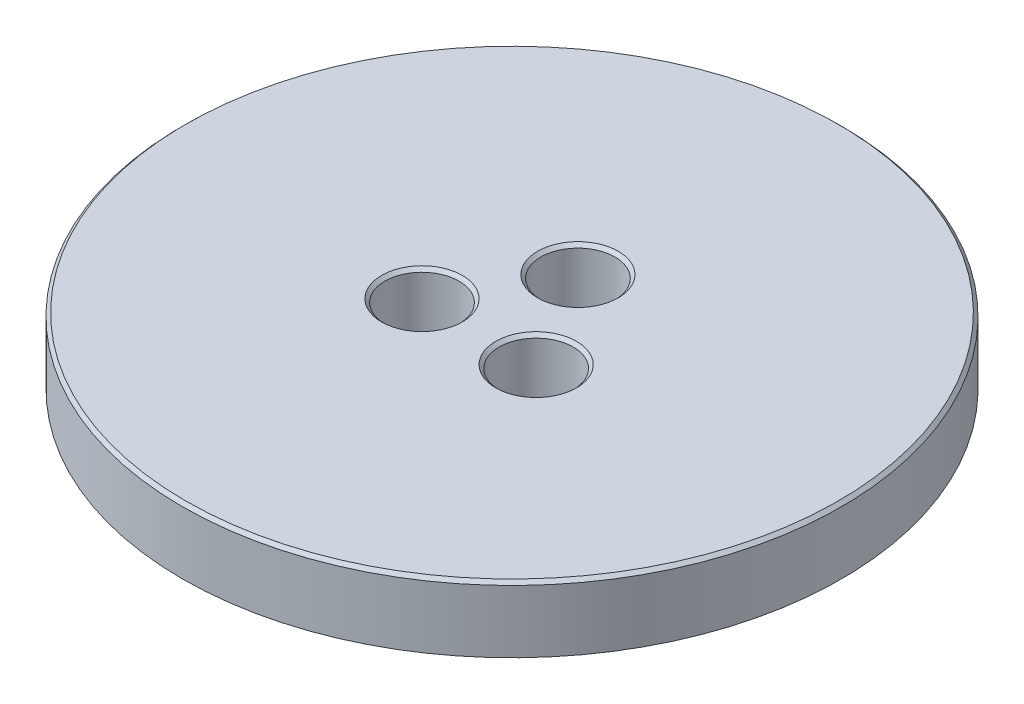
from build123d import *

# Parameters (mm, degrees)
SKETCH1_W          = 10
SKETCH1_H          = 2
SKETCH2_R          = 1.125
CUT_EXTRUDE1_DEPTH = 15.282856857
CHAMFER2_SIZE      = 0.1


with BuildPart() as part:
    # Sketch1 → Revolve1 (revolve)
    with BuildSketch(Plane.XY, mode=Mode.PRIVATE) as revolve1_sk:
        with Locations((5, 1)):
            Rectangle(SKETCH1_W, SKETCH1_H)
    revolve(revolve1_sk.sketch.rotate(Axis((0, 0, 0), (0, 1, 0)), 90), axis=Axis((0, 0, 0), (0, 1, 0)))

    # Sketch2 → Cut-Extrude1 (cut, through all)
    with BuildSketch(Plane(origin=(0, 0, 0), x_dir=(1, 0, 0), z_dir=(0, 1, 0))):
        with Locations(Location((-1.732050808, -1, 0), (0, 0, 270))):
            Circle(SKETCH2_R)
        with Locations(Location((1.732050808, -1, 0), (0, 0, 270))):
            Circle(SKETCH2_R)
        with Locations(Location((0, 2, 0), (0, 0, 270))):
            Circle(SKETCH2_R)
    extrude(amount=CUT_EXTRUDE1_DEPTH, mode=Mode.SUBTRACT)

    # Chamfer2
    chamfer2_edges = [part.edges().sort_by_distance(p)[0] for p in [
        (0, 2, -3.125),
        (-1.732050808, 2, -0.125),
        (1.732050808, 2, -0.125),
        (0, 2, 10),
    ]]
    chamfer(chamfer2_edges, length=CHAMFER2_SIZE)


solid = part.part
